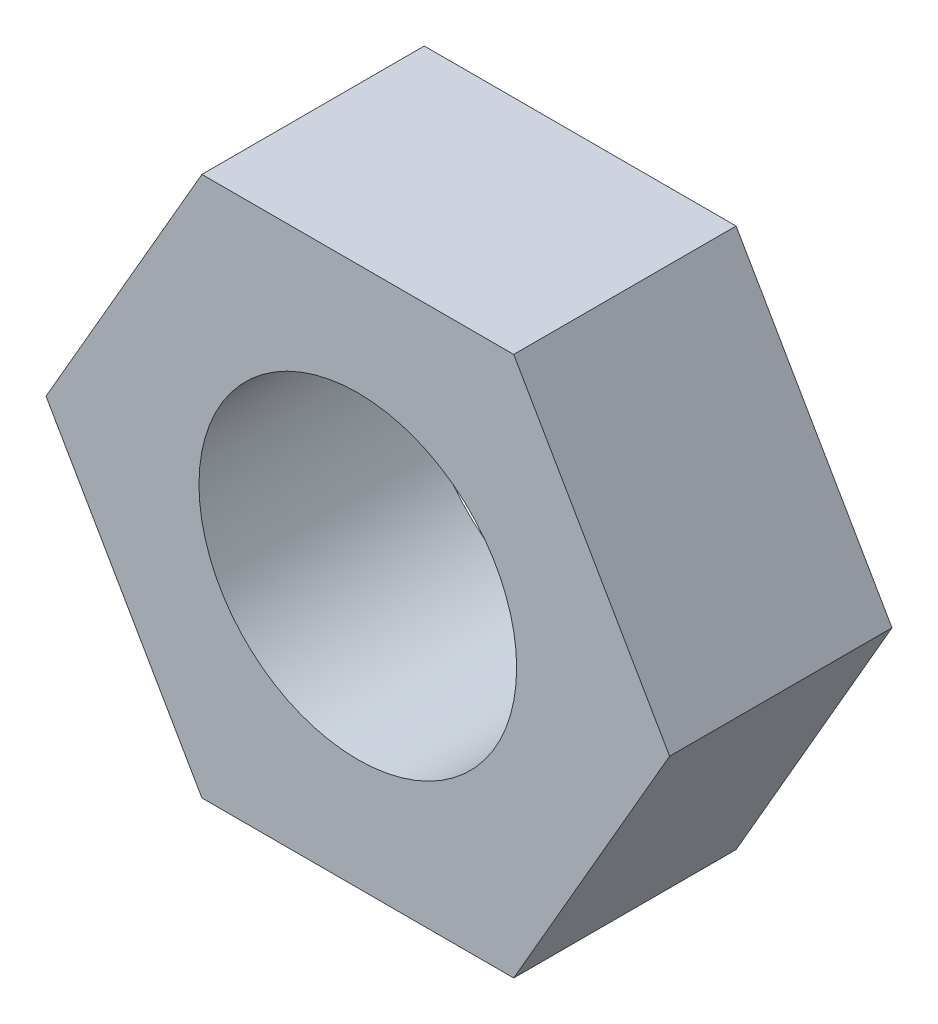
from build123d import *

# Parameters (mm, degrees)
ESQUISSE1_R        = 5
BOSS_EXTRU_1_DEPTH = 7


with BuildPart() as part:
    # Esquisse1 → Boss.-Extru.1 (new body)
    with BuildSketch(Plane.XY):
        Polygon((9.814954576, 0), (4.907477288, 8.5), (-4.907477288, 8.5), (-9.814954576, 0), (-4.907477288, -8.5), (4.907477288, -8.5), align=None)
        Circle(ESQUISSE1_R, mode=Mode.SUBTRACT)
    extrude(amount=BOSS_EXTRU_1_DEPTH)


solid = part.part
